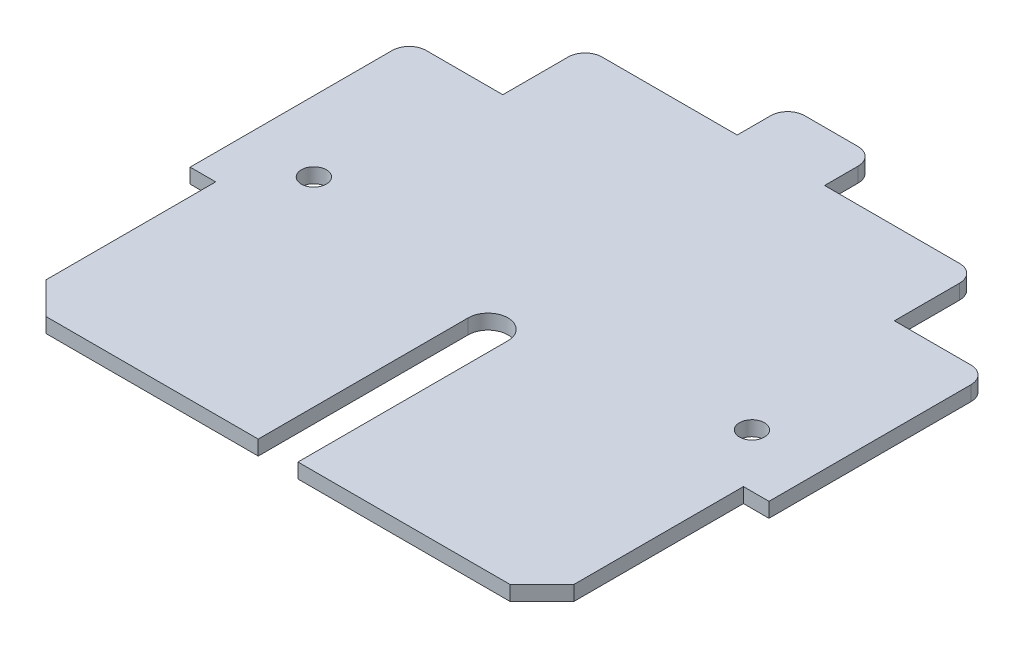
from build123d import *

# Parameters (mm, degrees)
SKETCH1_R           = 1.1
BOSS_EXTRUDE1_DEPTH = 0.65


with BuildPart() as part:
    # Sketch1 → Boss-Extrude1 (new, symmetric)
    with BuildSketch(Plane(origin=(0, 0, 0), x_dir=(1, 0, 0), z_dir=(0, 1, 0))):
        with BuildLine():
            Line((20.45, -24.375), (23.25, -21.575))
            Line((23.25, -21.575), (23.25, -8.875))
            Line((23.25, -8.875), (23.25, -6.625))
            Line((23.25, -6.625), (25.5, -6.625))
            Line((25.5, -6.625), (25.5, 11.175))
            ThreePointArc((25.5, 11.175), (25.060660172, 12.235660172), (24, 12.675))
            Line((24, 12.675), (17.25, 12.675))
            Line((17.25, 12.675), (17.25, 18.425))
            ThreePointArc((17.25, 18.425), (16.810660172, 19.485660172), (15.75, 19.925))
            Line((15.75, 19.925), (3.85, 19.925))
            Line((3.85, 19.925), (3.85, 22.875))
            ThreePointArc((3.85, 22.875), (3.410660172, 23.935660172), (2.35, 24.375))
            Line((2.35, 24.375), (-2.35, 24.375))
            ThreePointArc((-2.35, 24.375), (-3.410660172, 23.935660172), (-3.85, 22.875))
            Line((-3.85, 22.875), (-3.85, 19.925))
            Line((-3.85, 19.925), (-15.75, 19.925))
            ThreePointArc((-15.75, 19.925), (-16.810660172, 19.485660172), (-17.25, 18.425))
            Line((-17.25, 18.425), (-17.25, 12.675))
            Line((-17.25, 12.675), (-24, 12.675))
            ThreePointArc((-24, 12.675), (-25.060660172, 12.235660172), (-25.5, 11.175))
            Line((-25.5, 11.175), (-25.5, -6.625))
            Line((-25.5, -6.625), (-23.25, -6.625))
            Line((-23.25, -6.625), (-23.25, -8.875))
            Line((-23.25, -8.875), (-23.25, -21.575))
            Line((-23.25, -21.575), (-20.45, -24.375))
            Line((-20.45, -24.375), (-1.75, -24.375))
            Line((-1.75, -24.375), (-1.75, -5.875))
            ThreePointArc((-1.75, -5.875), (0, -4.125), (1.75, -5.875))
            Line((1.75, -5.875), (1.75, -24.375))
            Line((1.75, -24.375), (20.45, -24.375))
        make_face()
        with Locations(Location((19.3, -1.925, 0), (0, 0, 270))):
            Circle(SKETCH1_R, mode=Mode.SUBTRACT)
        with Locations(Location((-19.3, -1.925, 0), (0, 0, 90))):
            Circle(SKETCH1_R, mode=Mode.SUBTRACT)
    extrude(amount=BOSS_EXTRUDE1_DEPTH, both=True)


solid = part.part
